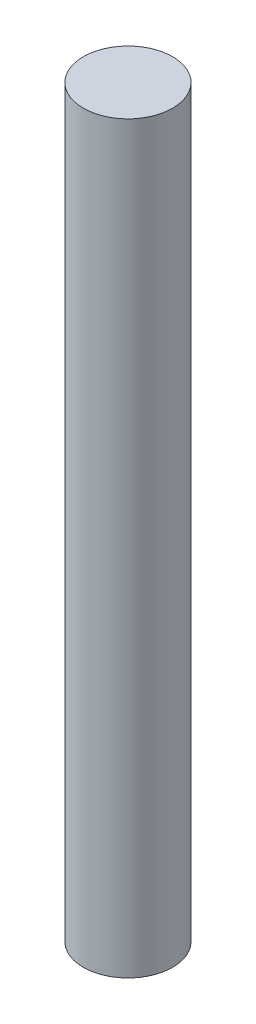
from build123d import *

# Parameters (mm, degrees)
SKETCH_1_R      = 1.5
EXTRUDE_1_DEPTH = 25


with BuildPart() as part:
    # 草图1 → 凸台-拉伸1 (new body)
    with BuildSketch(Plane(origin=(0, 0, 0), x_dir=(1, 0, 0), z_dir=(0, 1, 0))):
        with Locations(Location((0, 0, 0), (0, 0, 270))):
            Circle(SKETCH_1_R)
    extrude(amount=EXTRUDE_1_DEPTH)


solid = part.part
